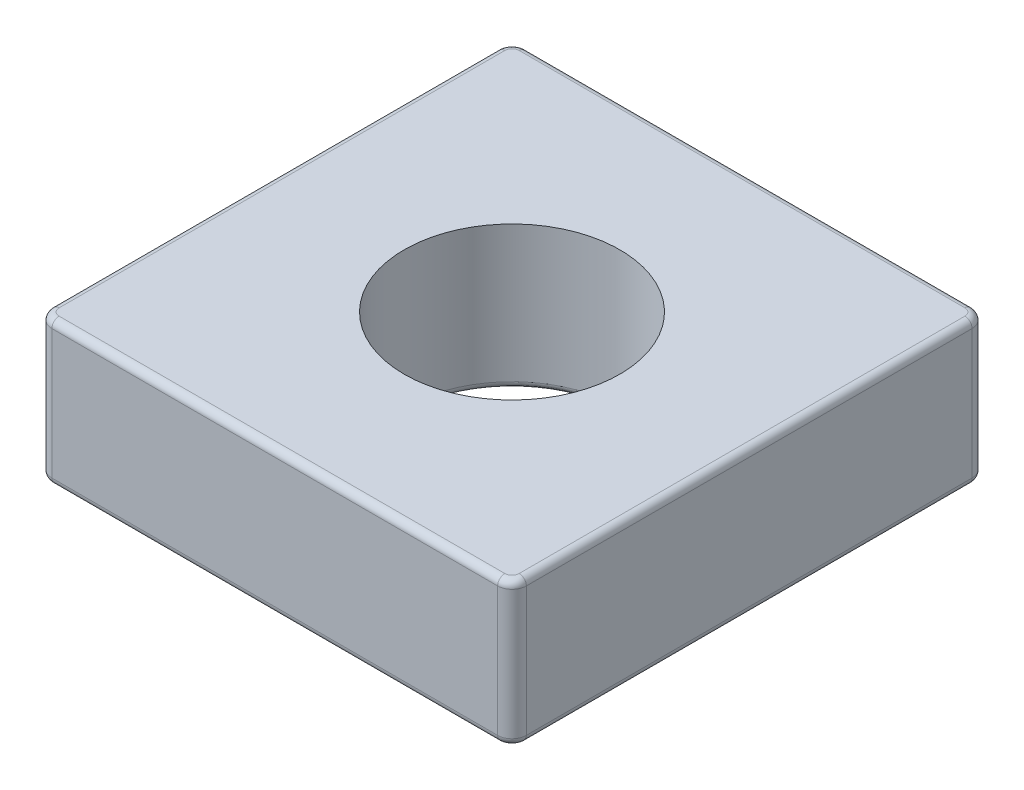
from build123d import *

# Parameters (mm, degrees)
SKETCH_1_W          = 6.6
SKETCH_1_H          = 6.6
EXTRUDE_1_DEPTH     = 2
SKETCH_2_R          = 1.5
CUT_EXTRUDE_1_DEPTH = 2
FILLET_1_R          = 0.2
FILLET_2_R          = 0.1


with BuildPart() as part:
    # 草图1 → 凸台-拉伸1 (new body)
    with BuildSketch(Plane(origin=(0, 0, 0), x_dir=(1, 0, 0), z_dir=(0, 1, 0))):
        Rectangle(SKETCH_1_W, SKETCH_1_H)
    extrude(amount=EXTRUDE_1_DEPTH)

    # 草图2 → 切除-拉伸1 (cut)
    with BuildSketch(Plane(origin=(0, 2, 0), x_dir=(1, 0, 0), z_dir=(0, 1, 0))):
        with Locations(Location((0, 0, 0), (0, 0, 270))):
            Circle(SKETCH_2_R)
    extrude(amount=-CUT_EXTRUDE_1_DEPTH, mode=Mode.SUBTRACT)

    # 圆角1
    fillet_1_edges = [part.edges().sort_by_distance(p)[0] for p in [
        (-3.3, 1, -3.3),
        (3.3, 1, -3.3),
        (3.3, 1, 3.3),
        (-3.3, 1, 3.3),
    ]]
    fillet(fillet_1_edges, radius=FILLET_1_R)

    # 圆角2
    fillet_2_edges = [part.edges().sort_by_distance(p)[0] for p in [
        (0, 0, -1.5),
        (-3.3, 0, 0),
        (-3.3, 2, 0),
        (0, 0, -3.3),
        (3.3, 0, 0),
        (0, 0, 3.3),
        (-3.241421356, 0, 3.241421356),
        (3.241421356, 0, 3.241421356),
        (3.241421356, 0, -3.241421356),
        (-3.241421356, 0, -3.241421356),
        (0, 2, -3.3),
        (0, 2, 3.3),
        (3.3, 2, 0),
        (-3.241421356, 2, 3.241421356),
        (3.241421356, 2, 3.241421356),
        (3.241421356, 2, -3.241421356),
        (-3.241421356, 2, -3.241421356),
    ]]
    fillet(fillet_2_edges, radius=FILLET_2_R)


solid = part.part
